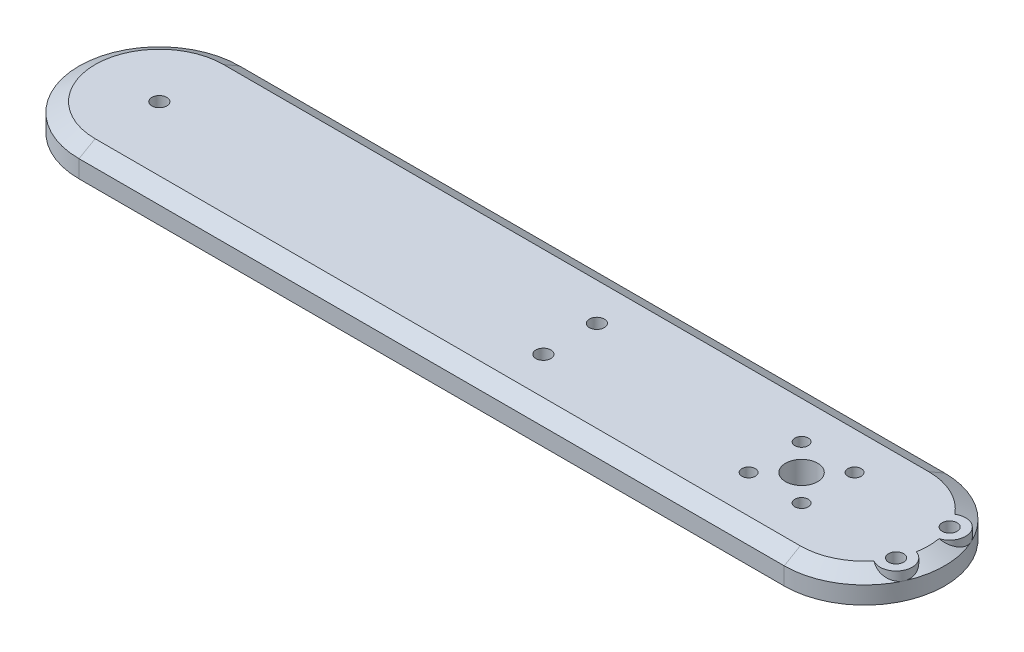
from build123d import *

# Parameters (mm, degrees)
SKETCH1_R           = 1.4
SKETCH1_R_2         = 3
SKETCH1_R_3         = 1.25
BOSS_EXTRUDE2_DEPTH = 5
CHAMFER1_SIZE       = 3
CHAMFER1_SIZE2      = 1.732050808
SKETCH4_R           = 1.4
CUT_EXTRUDE2_DEPTH  = 148.599330961
SKETCH5_R           = 3
BOSS_EXTRUDE3_DEPTH = 5
SKETCH6_R           = 1.4
CUT_EXTRUDE3_DEPTH  = 148.59933107


with BuildPart() as part:
    # Sketch1 → Boss-Extrude2 (new body)
    with BuildSketch(Plane(origin=(0, 0, 0), x_dir=(1, 0, 0), z_dir=(0, 1, 0))):
        with BuildLine():
            Line((0, 15), (131.75, 15))
            ThreePointArc((131.75, 15), (146.75, 0), (131.75, -15))
            Line((131.75, -15), (0, -15))
            ThreePointArc((0, -15), (-15, 0), (0, 15))
        make_face()
        Circle(SKETCH1_R, mode=Mode.SUBTRACT)
        with Locations((120, 0)):
            Circle(SKETCH1_R_2, mode=Mode.SUBTRACT)
        with Locations((115.050252532, 4.949747468)):
            Circle(SKETCH1_R_3, mode=Mode.SUBTRACT)
        with Locations((124.949747468, 4.949747468)):
            Circle(SKETCH1_R_3, mode=Mode.SUBTRACT)
        with Locations((124.949747468, -4.949747468)):
            Circle(SKETCH1_R_3, mode=Mode.SUBTRACT)
        with Locations((115.050252532, -4.949747468)):
            Circle(SKETCH1_R_3, mode=Mode.SUBTRACT)
    extrude(amount=BOSS_EXTRUDE2_DEPTH)

    # Chamfer1
    chamfer1_edges = [part.edges().sort_by_distance(p)[0] for p in [
        (146.75, 5, 0),
        (65.875, 5, 15),
        (-15, 5, 0),
        (65.875, 5, -15),
    ]]
    chamfer1_side = [part.faces().sort_by_distance(p)[0] for p in [
        (65.400010858, 5, 0),
    ]]
    chamfer(chamfer1_edges, length=CHAMFER1_SIZE, length2=CHAMFER1_SIZE2, reference=chamfer1_side[0])

    # Sketch4 → Cut-Extrude2 (cut, through all)
    with BuildSketch(Plane(origin=(0, 5, 0), x_dir=(1, 0, 0), z_dir=(0, 1, 0))):
        with Locations((76.75, 5)):
            Circle(SKETCH4_R)
        with Locations((76.75, -5)):
            Circle(SKETCH4_R)
    extrude(amount=-CUT_EXTRUDE2_DEPTH, mode=Mode.SUBTRACT)

    # Sketch5 → Boss-Extrude3 (add)
    with BuildSketch(Plane(origin=(0, 5, 0), x_dir=(1, 0, 0), z_dir=(0, 1, 0))):
        with Locations((142.658712115, -5)):
            Circle(SKETCH5_R)
    boss_extrude3 = extrude(amount=-BOSS_EXTRUDE3_DEPTH)

    # Sketch6 → Cut-Extrude3 (cut, through all)
    with BuildSketch(Plane(origin=(0, 5, 0), x_dir=(1, 0, 0), z_dir=(0, 1, 0))):
        with Locations((142.658712115, -5)):
            Circle(SKETCH6_R)
    cut_extrude3 = extrude(amount=-CUT_EXTRUDE3_DEPTH, mode=Mode.SUBTRACT)

    # Mirror1: Boss-Extrude3, Cut-Extrude3 across plane
    add(boss_extrude3.mirror(Plane.XY))
    add(cut_extrude3.mirror(Plane.XY), mode=Mode.SUBTRACT)


solid = part.part
